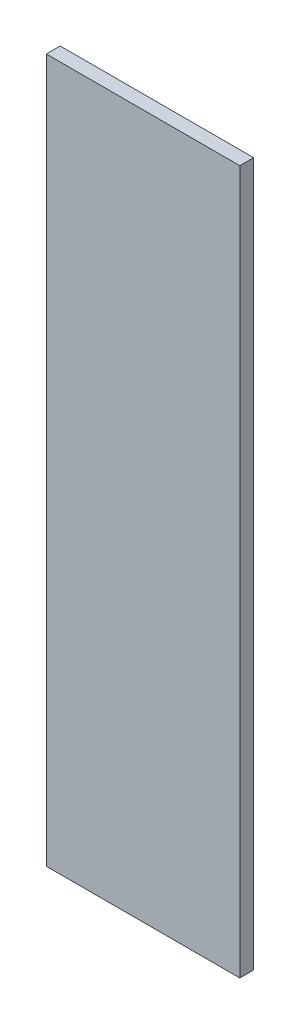
from build123d import *

# Parameters (mm, degrees)
SKETCH1_W           = 2.794
SKETCH1_H           = 10.16
BOSS_EXTRUDE1_DEPTH = 0.2


with BuildPart() as part:
    # Sketch1 → Boss-Extrude1 (new body)
    with BuildSketch(Plane.XY):
        with Locations((1.397, 5.08)):
            Rectangle(SKETCH1_W, SKETCH1_H)
    extrude(amount=BOSS_EXTRUDE1_DEPTH)


solid = part.part
